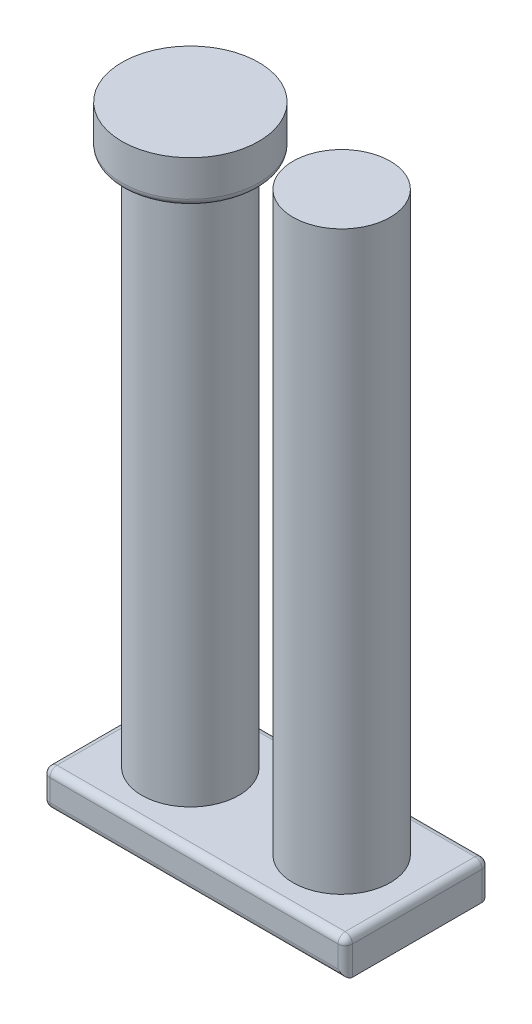
from build123d import *

# Parameters (mm, degrees)
SKETCH1_W           = 42
SKETCH1_H           = 20
BOSS_EXTRUDE1_DEPTH = 5
SKETCH1_3_R         = 6.75
BOSS_EXTRUDE2_DEPTH = 85
SKETCH2_R           = 9.5
BOSS_EXTRUDE3_DEPTH = 6
FILLET1_R           = 1


with BuildPart() as part:
    # Sketch1 → Boss-Extrude1 (new body)
    with BuildSketch(Plane(origin=(0, 0, 0), x_dir=(1, 0, 0), z_dir=(0, 1, 0))):
        Rectangle(SKETCH1_W, SKETCH1_H)
    extrude(amount=BOSS_EXTRUDE1_DEPTH)

    # Sketch1<3> → Boss-Extrude2 (add)
    with BuildSketch(Plane(origin=(0, 0, 0), x_dir=(1, 0, 0), z_dir=(0, 1, 0))):
        with Locations((-10.5, 0)):
            Circle(SKETCH1_3_R)
        with Locations((10.5, 0)):
            Circle(SKETCH1_3_R)
    extrude(amount=BOSS_EXTRUDE2_DEPTH)

    # Sketch2 → Boss-Extrude3 (add)
    with BuildSketch(Plane(origin=(0, 85, 0), x_dir=(1, 0, 0), z_dir=(0, 1, 0))):
        with Locations((-10.5, 0)):
            Circle(SKETCH2_R)
    extrude(amount=-BOSS_EXTRUDE3_DEPTH)

    # Fillet1
    fillet1_edges = [part.edges().sort_by_distance(p)[0] for p in [
        (21, 2.5, -10),
        (0, 0, -10),
        (21, 2.5, 10),
        (0, 0, 10),
        (0, 5, 10),
        (0, 5, -10),
        (21, 5, 0),
        (-21, 2.5, -10),
        (-21, 5, 0),
        (-21, 2.5, 10),
        (-21, 0, 0),
        (-20, 79, 0),
        (-17.25, 79, 0),
    ]]
    fillet(fillet1_edges, radius=FILLET1_R)


solid = part.part
